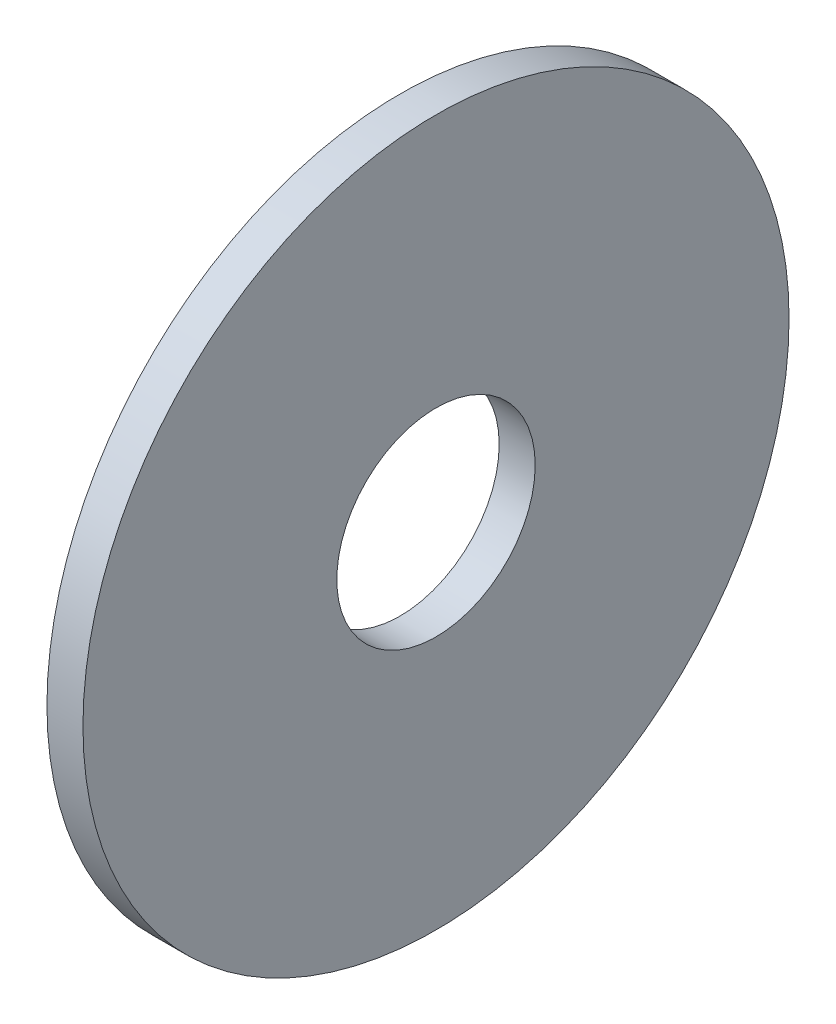
from build123d import *

# Parameters (mm, degrees)
SKETCH1_R           = 12.7
SKETCH1_R_2         = 3.5687
BOSS_EXTRUDE1_DEPTH = 1.2954


with BuildPart() as part:
    # Sketch1 → Boss-Extrude1 (new body)
    with BuildSketch(Plane(origin=(0, 0, 0), x_dir=(0, 0, -1), z_dir=(1, 0, 0))):
        Circle(SKETCH1_R)
        Circle(SKETCH1_R_2, mode=Mode.SUBTRACT)
    extrude(amount=BOSS_EXTRUDE1_DEPTH)


solid = part.part
